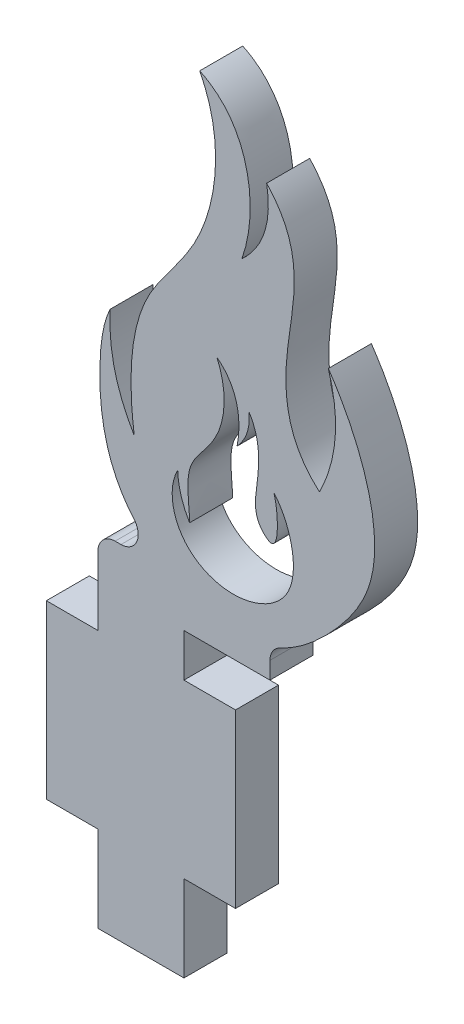
from build123d import *

# Parameters (mm, degrees)
SKETCH_1_W      = 3
SKETCH_1_H      = 10
SKETCH_1_W_2    = 5
SKETCH_1_H_2    = 20
EXTRUDE_1_DEPTH = 2.5
SKETCH_2_W      = 5
SKETCH_2_H      = 2.5
EXTRUDE_3_DEPTH = 2.5
EXTRUDE_4_DEPTH = 2.5
FILLET_1_R      = 1


with BuildPart() as part:
    # 草图1 → 凸台-拉伸1 (new body)
    with BuildSketch(Plane.XY):
        with Locations((-4, 0)):
            Rectangle(SKETCH_1_W, SKETCH_1_H)
        Rectangle(SKETCH_1_W_2, SKETCH_1_H_2)
        with Locations((4, 0)):
            Rectangle(SKETCH_1_W, SKETCH_1_H)
    extrude(amount=EXTRUDE_1_DEPTH)

    # 草图2 → 凸台-拉伸3 (add)
    with BuildSketch(Plane.XY.offset(2.5)):
        with Locations((5, 8.75)):
            Rectangle(SKETCH_2_W, SKETCH_2_H)
    extrude(amount=-EXTRUDE_3_DEPTH)

    # 草图3 → 凸台-拉伸4 (add)
    with BuildSketch(Plane.XY):
        with BuildLine():
            add(Edge.make_bspline(
                [(2.909166473, 9.462916852), (-2.415095275, 11.413939745), (-2.382729554, 20.340359213), (-1.791159912, 21.531322434)],
                knots=[0, 0, 0, 0.735562892, 1, 1, 1], degree=2))
            add(Edge.make_bspline(
                [(-1.791159912, 21.531322434), (-1.960201232, 18.490050647), (-0.386815041, 15.86404983)],
                knots=[0, 0, 0, 1, 1, 1], degree=2))
            add(Edge.make_bspline(
                [(-0.386815041, 15.86404983), (-0.710711682, 18.231758312), (-0.730459832, 22.706300044), (4.366438343, 27.931127178), (4.877324626, 33.357459928), (3.417309866, 36.140444981)],
                knots=[0, 0, 0, 0, 0.347000482, 0.559930801, 1, 1, 1, 1], degree=3))
            add(Edge.make_bspline(
                [(3.417309866, 36.140444981), (6.425369509, 34.731785706), (6.875869697, 30.683717346), (5.867418917, 27.90080749)],
                knots=[0, 0, 0, 0, 1, 1, 1, 1], degree=3))
            add(Edge.make_bspline(
                [(5.867418917, 27.90080749), (7.795793944, 29.684649261), (7.309638514, 32.427774559)],
                knots=[0, 0, 0, 1, 1, 1], degree=2))
            add(Edge.make_bspline(
                [(7.309638514, 32.427774559), (9.799469138, 29.791682599), (7.925287293, 24.979549302), (8.569671496, 19.9896001), (10.380756945, 18.41594542)],
                knots=[0, 0, 0, 0, 0.581503319, 1, 1, 1, 1], degree=3))
            add(Edge.make_bspline(
                [(10.380756945, 18.41594542), (11.946226348, 21.526199715), (10.896788229, 24.893496012)],
                knots=[0, 0, 0, 1, 1, 1], degree=2))
            add(Edge.make_bspline(
                [(10.896788229, 24.893496012), (12.64972713, 22.353469832), (14.94688254, 16.787009136), (10.238202027, 10.257823069), (6.399430517, 7.87311155), (2.909166473, 9.462916852)],
                knots=[0, 0, 0, 0, 0.442622305, 0.610975298, 1, 1, 1, 1], degree=3))
        make_face()
        with BuildLine():
            add(Edge.make_bspline(
                [(2.138293561, 15.389413184), (1.565216395, 14.302849067), (1.989570498, 11.703647244), (5.522471535, 10.241080078), (9.730791334, 12.237177784), (8.68425822, 15.991930054), (7.71397605, 17.077463845)],
                knots=[0, 0, 0, 0, 0.234608912, 0.444601304, 0.670183477, 1, 1, 1, 1], degree=3))
            add(Edge.make_bspline(
                [(7.71397605, 17.077463845), (7.917206002, 16.676345138), (8.228664484, 13.713534992), (6.488750006, 15.261680135), (6.855872826, 17.479461539), (6.969976099, 19.315575439), (6.28169064, 20.402412119)],
                knots=[0, 0, 0, 0, 0.298390972, 0.375084696, 0.606753796, 1, 1, 1, 1], degree=3))
            add(Edge.make_bspline(
                [(5.59112446, 18.330713579), (6.398305864, 19.200286486), (6.28169064, 20.402412119)],
                knots=[0, 0, 0, 1, 1, 1], degree=2))
            add(Edge.make_bspline(
                [(4.414604302, 22.218345406), (5.643418978, 21.298941546), (5.879978633, 19.703315032), (5.59112446, 18.330713579)],
                knots=[0, 0, 0, 0, 1, 1, 1, 1], degree=3))
            add(Edge.make_bspline(
                [(2.828859741, 13.087525918), (2.828226763, 13.997455917), (2.393895179, 15.836493753), (3.947689734, 17.386184776), (5.014150899, 19.389667091), (4.889086339, 21.178881355), (4.414604302, 22.218345406)],
                knots=[0, 0, 0, 0, 0.302041838, 0.493836745, 0.643329375, 1, 1, 1, 1], degree=3))
            add(Edge.make_bspline(
                [(2.138293561, 15.389413184), (2.181401854, 14.156825875), (2.828859741, 13.087525918)],
                knots=[0, 0, 0, 1, 1, 1], degree=2))
        make_face(mode=Mode.SUBTRACT)
    extrude(amount=EXTRUDE_4_DEPTH)

    # 圆角1
    fillet_1_edges = [part.edges().sort_by_distance(p)[0] for p in [
        (-2.5, 10, 1.25),
        (1.70390459, 10, 1.25),
        (7.5, 9.165481652, 1.25),
    ]]
    fillet(fillet_1_edges, radius=FILLET_1_R)


solid = part.part
